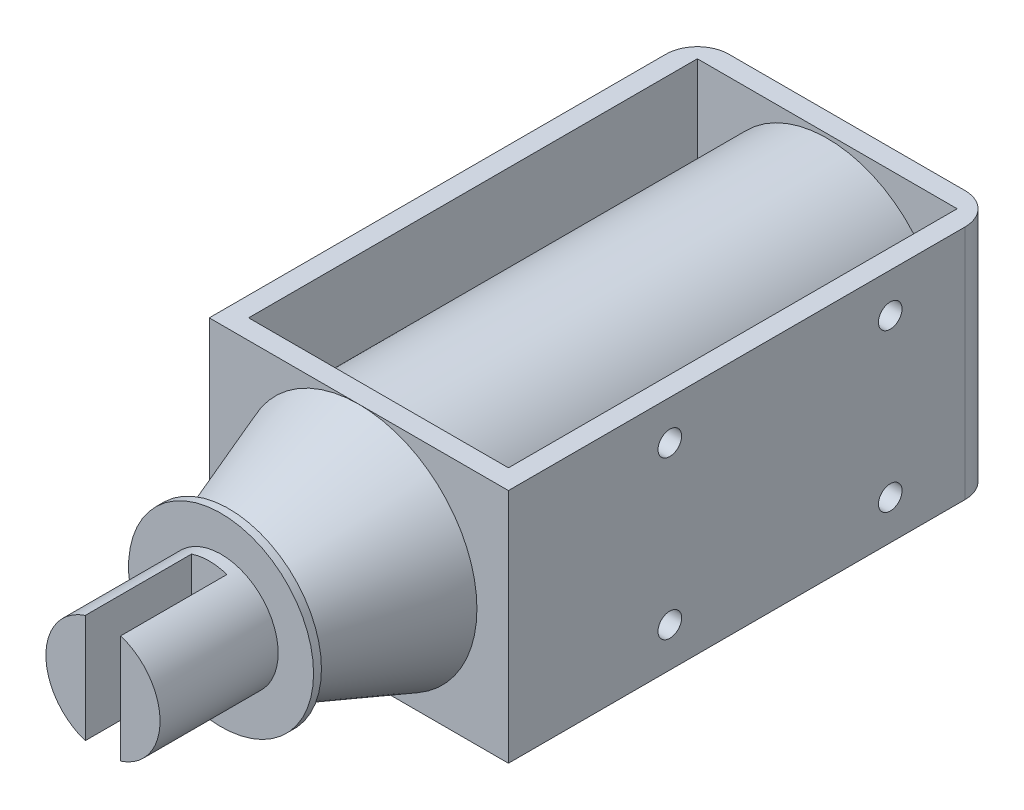
from build123d import *

# Parameters (mm, degrees)
SKETCH1_W           = 38
SKETCH1_H           = 62
BOSS_EXTRUDE1_DEPTH = 30
SKETCH2_W           = 33
SKETCH2_H           = 57
CUT_EXTRUDE1_DEPTH  = 30
FILLET1_R           = 4
SKETCH3_R           = 1.5
CUT_EXTRUDE2_DEPTH  = 2.5
SKETCH4_R           = 14.5
BOSS_EXTRUDE2_DEPTH = 57
SKETCH5_R           = 4.25
BOSS_EXTRUDE3_DEPTH = 0.5
BOSS_EXTRUDE4_DEPTH = 2.5
SKETCH8_R           = 3.6
BOSS_EXTRUDE5_DEPTH = 4.5
FILLET2_R           = 2
SKETCH10_R          = 7.25
BOSS_EXTRUDE6_DEPTH = 16.5
SKETCH11_R          = 11.75
BOSS_EXTRUDE7_DEPTH = 1
SKETCH12_R          = 7.25
BOSS_EXTRUDE8_DEPTH = 15
SKETCH13_W          = 4.5
SKETCH13_H          = 14.5
CUT_EXTRUDE3_DEPTH  = 13.5
SKETCH15_R          = 15
BOSS_EXTRUDE9_DEPTH = 16.5
BOSS_EXTRUDE9_TAPER = 20


with BuildPart() as part:
    # Sketch1 → Boss-Extrude1 (new body)
    with BuildSketch(Plane(origin=(0, 0, 0), x_dir=(1, 0, 0), z_dir=(0, 1, 0))):
        Rectangle(SKETCH1_W, SKETCH1_H)
    extrude(amount=BOSS_EXTRUDE1_DEPTH)

    # Sketch2 → Cut-Extrude1 (cut)
    with BuildSketch(Plane(origin=(0, 30, 0), x_dir=(1, 0, 0), z_dir=(0, 1, 0))):
        Rectangle(SKETCH2_W, SKETCH2_H)
    extrude(amount=-CUT_EXTRUDE1_DEPTH, mode=Mode.SUBTRACT)

    # Fillet1
    fillet1_edges = [part.edges().sort_by_distance(p)[0] for p in [
        (-19, 15, -31),
        (19, 15, -31),
    ]]
    fillet(fillet1_edges, radius=FILLET1_R)

    # Sketch3 → Cut-Extrude2 (cut)
    with BuildSketch(Plane(origin=(19, 0, 0), x_dir=(0, 0, -1), z_dir=(1, 0, 0))):
        with Locations((17.5, 25)):
            Circle(SKETCH3_R)
        with Locations((17.5, 5)):
            Circle(SKETCH3_R)
        with Locations((-10.5, 25)):
            Circle(SKETCH3_R)
        with Locations((-10.5, 5)):
            Circle(SKETCH3_R)
    extrude(amount=-CUT_EXTRUDE2_DEPTH, mode=Mode.SUBTRACT)

    # Sketch4 → Boss-Extrude2 (add)
    with BuildSketch(Plane.XY.offset(-28.5)):
        with Locations(Location((0, 15, 0), (0, 0, 180))):
            Circle(SKETCH4_R)
    extrude(amount=BOSS_EXTRUDE2_DEPTH)

    # Sketch5 → Boss-Extrude3 (add)
    with BuildSketch(Plane(origin=(0, 0, -31), x_dir=(-1, 0, 0), z_dir=(0, 0, -1))):
        with Locations(Location((0, 15, 0), (0, 0, 180))):
            Circle(SKETCH5_R)
    extrude(amount=BOSS_EXTRUDE3_DEPTH)

    # Sketch6 → Boss-Extrude4 (add)
    with BuildSketch(Plane(origin=(0, 0, -31.5), x_dir=(-1, 0, 0), z_dir=(0, 0, -1))):
        Polygon((0, 19.25), (-3.680607966, 17.125), (-3.680607966, 12.875), (0, 10.75), (3.680607966, 12.875), (3.680607966, 17.125), align=None)
    extrude(amount=BOSS_EXTRUDE4_DEPTH)

    # Sketch8 → Boss-Extrude5 (add)
    with BuildSketch(Plane(origin=(0, 0, -34), x_dir=(-1, 0, 0), z_dir=(0, 0, -1))):
        with Locations((0, 15)):
            Circle(SKETCH8_R)
    extrude(amount=BOSS_EXTRUDE5_DEPTH)

    # Fillet2
    fillet2_edges = [part.edges().sort_by_distance(p)[0] for p in [
        (3.6, 15, -38.5),
    ]]
    fillet(fillet2_edges, radius=FILLET2_R)

    # Sketch10 → Boss-Extrude6 (add)
    with BuildSketch(Plane.XY.offset(31)):
        with Locations((0, 15)):
            Circle(SKETCH10_R)
    extrude(amount=BOSS_EXTRUDE6_DEPTH)

    # Sketch11 → Boss-Extrude7 (add)
    with BuildSketch(Plane.XY.offset(47.5)):
        with Locations((0, 15)):
            Circle(SKETCH11_R)
    extrude(amount=BOSS_EXTRUDE7_DEPTH)

    # Sketch12 → Boss-Extrude8 (add)
    with BuildSketch(Plane.XY.offset(48.5)):
        with Locations((0, 15)):
            Circle(SKETCH12_R)
    extrude(amount=BOSS_EXTRUDE8_DEPTH)

    # Sketch13 → Cut-Extrude3 (cut)
    with BuildSketch(Plane.XY.offset(63.5)):
        with Locations((0, 15)):
            Rectangle(SKETCH13_W, SKETCH13_H)
    extrude(amount=-CUT_EXTRUDE3_DEPTH, mode=Mode.SUBTRACT)

    # Sketch15 → Boss-Extrude9 (add)
    with BuildSketch(Plane.XY.offset(31)):
        with Locations((0, 15)):
            Circle(SKETCH15_R)
    extrude(amount=BOSS_EXTRUDE9_DEPTH, taper=BOSS_EXTRUDE9_TAPER)


solid = part.part
